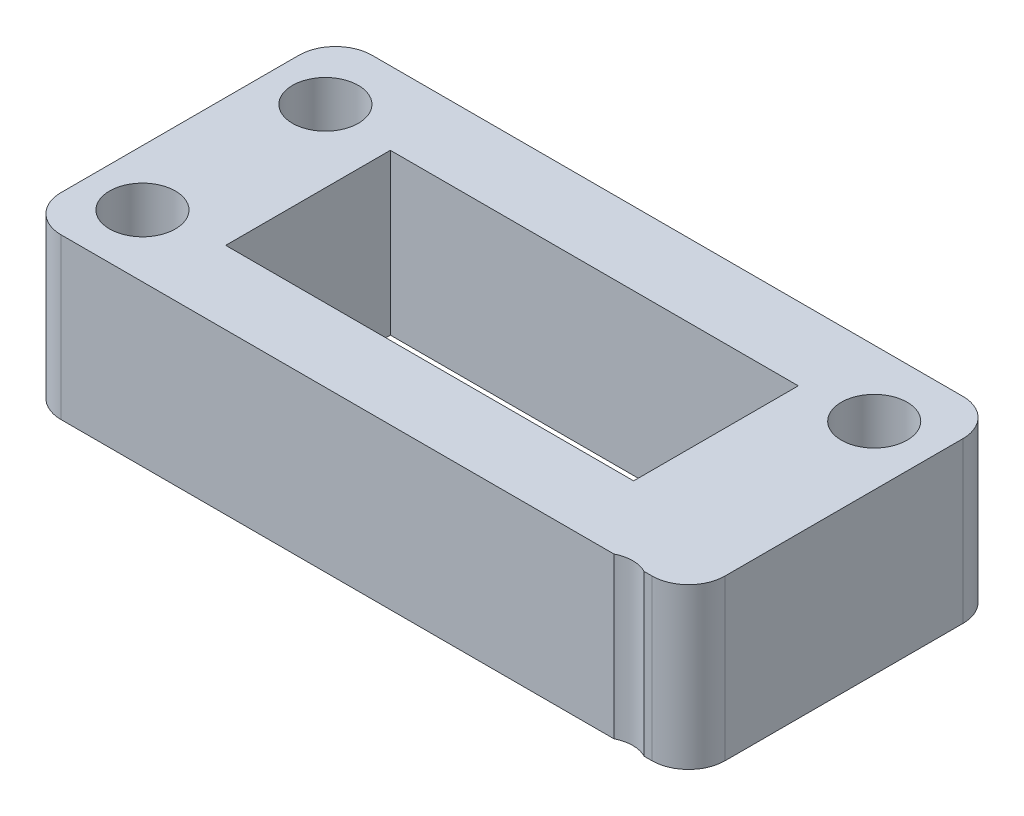
from build123d import *

# Parameters (mm, degrees)
SKETCH1_W            = 36.3
SKETCH1_H            = 17
SKETCH1_W_2          = 22.3
SKETCH1_H_2          = 9
BOSS_EXTRUDE1_DEPTH  = 8.75
M3_CLEARANCE_HOLE1_D = 3.6
FILLET1_R            = 2


with BuildPart() as part:
    # Sketch1 → Boss-Extrude1 (new body)
    with BuildSketch(Plane(origin=(0, 0, 0), x_dir=(1, 0, 0), z_dir=(0, 1, 0))):
        with Locations((18.15, 8.5)):
            Rectangle(SKETCH1_W, SKETCH1_H)
        with Locations((18.15, 8.5)):
            Rectangle(SKETCH1_W_2, SKETCH1_H_2, mode=Mode.SUBTRACT)
    extrude(amount=BOSS_EXTRUDE1_DEPTH)

    # M3 Clearance Hole1 (through all)
    with Locations(Plane(origin=(0, 8.75, 0), x_dir=(1, 0, 0), z_dir=(0, 1, 0))):
        with Locations((3.050005, 3.4), (33.050005, -1.6), (33.050005, 13.4), (3.050005, 13.4)):
            Hole(M3_CLEARANCE_HOLE1_D / 2)

    # Fillet1
    fillet1_edges = [part.edges().sort_by_distance(p)[0] for p in [
        (0, 4.375, -17),
        (36.3, 4.375, -17),
        (36.3, 4.375, 0),
        (0, 4.375, 0),
    ]]
    fillet(fillet1_edges, radius=FILLET1_R)


solid = part.part
